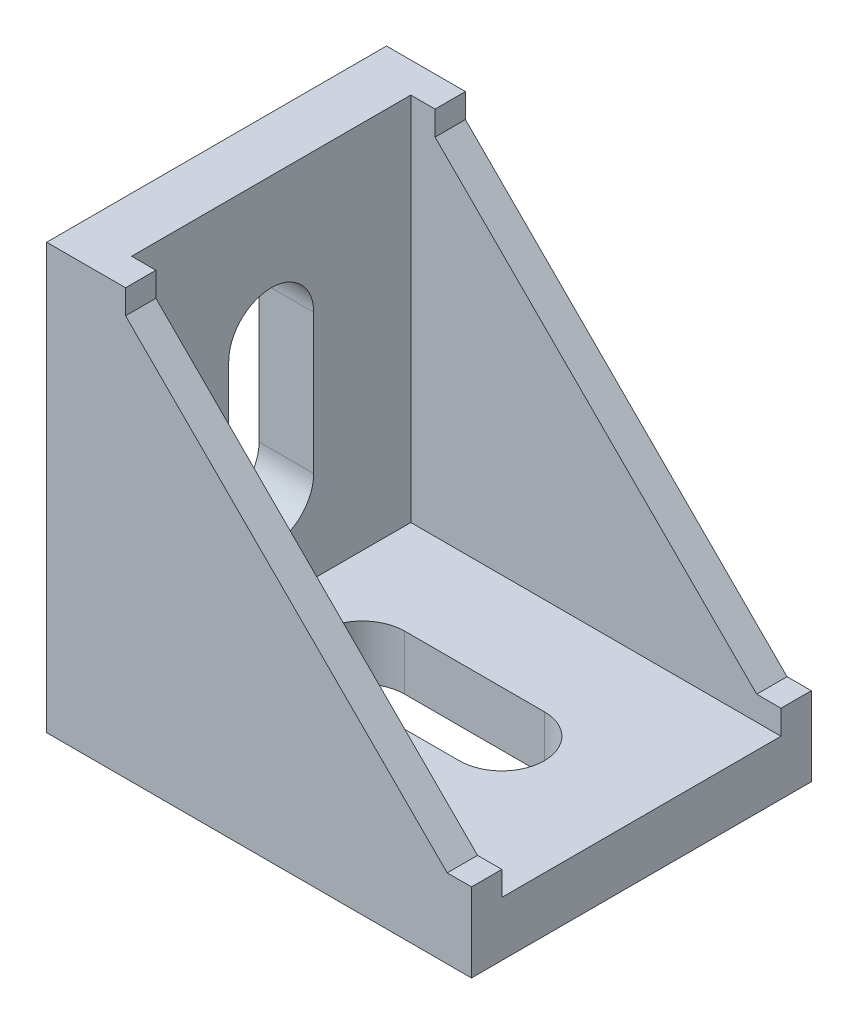
from build123d import *

# Parameters (mm, degrees)
SKETCH1_W           = 35
SKETCH1_H           = 35
BOSS_EXTRUDE1_DEPTH = 28
CUT_EXTRUDE1_DEPTH  = 57.868268832
CUT_EXTRUDE2_REACH  = 56.215
SKETCH3_W           = 23
SKETCH3_H           = 33.717030155
CUT_EXTRUDE3_DEPTH  = 4.5
CUT_EXTRUDE4_DEPTH  = 4.5
SKETCH6_W           = 1
SKETCH6_H           = 5.8
BOSS_EXTRUDE2_DEPTH = 1
SKETCH7_W           = 5.8
SKETCH7_H           = 1
BOSS_EXTRUDE3_DEPTH = 1


with BuildPart() as part:
    # Sketch1 → Boss-Extrude1 (new body)
    with BuildSketch(Plane.XY):
        with Locations((17.5, 17.5)):
            Rectangle(SKETCH1_W, SKETCH1_H)
    extrude(amount=BOSS_EXTRUDE1_DEPTH)

    # Sketch2 → Cut-Extrude1 (cut, through all)
    with BuildSketch(Plane.XY.offset(28)):
        Polygon((6.5, 37.082021278), (6.5, 33), (33, 6.5), (39.701272532, 6.5), (39.701272532, 37.082021278), align=None)
    extrude(amount=-CUT_EXTRUDE1_DEPTH, mode=Mode.SUBTRACT)

    # Cut-Extrude2: up to this face of the body (flat: up to its plane)
    cut_extrude2_end = Plane(part.part.faces().sort_by_distance((35, 3.25, 14))[0])
    # Sketch3 → Cut-Extrude2 (cut, up to the picked face)
    with BuildSketch(Plane.ZY.offset(-4.5), mode=Mode.PRIVATE) as cut_extrude2_sk1:
        with Locations((14, 21.358515078)):
            Rectangle(SKETCH3_W, SKETCH3_H)
    cut_extrude2_tool1 = split(extrude(cut_extrude2_sk1.sketch, amount=-CUT_EXTRUDE2_REACH, mode=Mode.PRIVATE), bisect_by=cut_extrude2_end, keep=Keep.BOTH, mode=Mode.PRIVATE)
    add(cut_extrude2_tool1.solids().sort_by(Axis((4.5, 21.358515, 14), (1, 0, 0)))[0], mode=Mode.SUBTRACT)

    # Sketch4 → Cut-Extrude3 (cut)
    with BuildSketch(Plane(origin=(4.5, 0, 0), x_dir=(0, 0, -1), z_dir=(1, 0, 0))):
        with BuildLine():
            Line((-10.5, 23.5), (-10.5, 12))
            ThreePointArc((-10.5, 12), (-14, 8.5), (-17.5, 12))
            Line((-17.5, 12), (-17.5, 23.5))
            ThreePointArc((-17.5, 23.5), (-14, 27), (-10.5, 23.5))
        make_face()
    extrude(amount=-CUT_EXTRUDE3_DEPTH, mode=Mode.SUBTRACT)

    # Sketch5 → Cut-Extrude4 (cut)
    with BuildSketch(Plane(origin=(0, 4.5, 0), x_dir=(1, 0, 0), z_dir=(0, 1, 0))):
        with BuildLine():
            Line((23.5, -17.5), (12, -17.5))
            ThreePointArc((12, -17.5), (8.5, -14), (12, -10.5))
            Line((12, -10.5), (23.5, -10.5))
            ThreePointArc((23.5, -10.5), (27, -14), (23.5, -17.5))
        make_face()
    extrude(amount=-CUT_EXTRUDE4_DEPTH, mode=Mode.SUBTRACT)

    # Sketch6 → Boss-Extrude2 (add)
    with BuildSketch(Plane.XZ):
        with Locations((33.5, 14)):
            Rectangle(SKETCH6_W, SKETCH6_H)
    extrude(amount=BOSS_EXTRUDE2_DEPTH)

    # Sketch7 → Boss-Extrude3 (add)
    with BuildSketch(Plane.ZY):
        with Locations((14, 33.5)):
            Rectangle(SKETCH7_W, SKETCH7_H)
    extrude(amount=BOSS_EXTRUDE3_DEPTH)


solid = part.part
